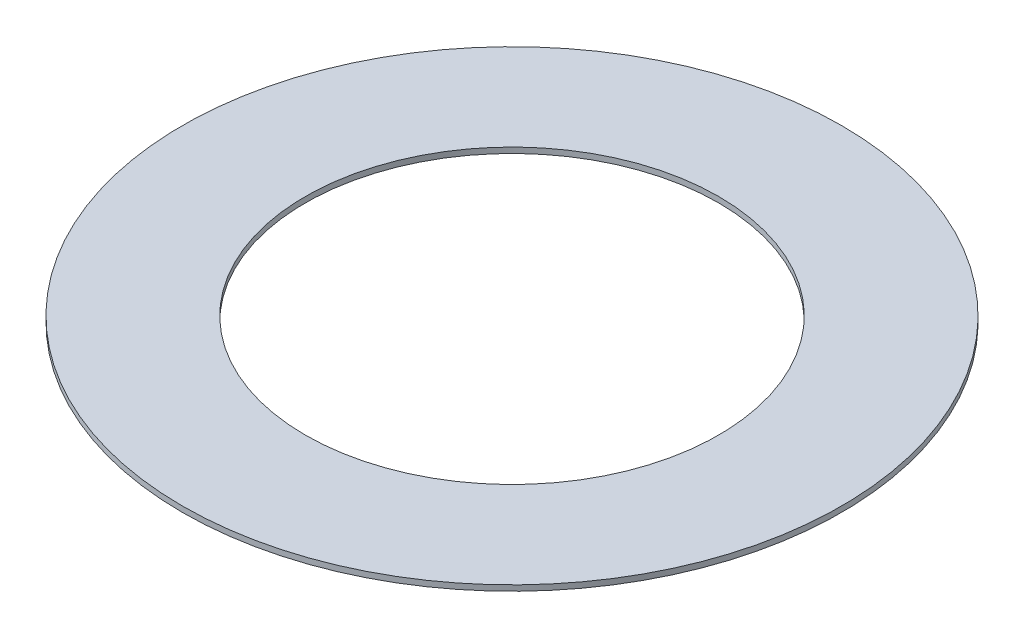
from build123d import *

# Parameters (mm, degrees)
SKETCH1_R           = 29.5
BOSS_EXTRUDE1_DEPTH = 0.5
SKETCH2_R           = 18.5
CUT_EXTRUDE1_DEPTH  = 42.722296198


with BuildPart() as part:
    # Sketch1 → Boss-Extrude1 (new body)
    with BuildSketch(Plane(origin=(0, 0, 0), x_dir=(1, 0, 0), z_dir=(0, 1, 0))):
        with Locations(Location((0, 0, 0), (0, 0, 270))):
            Circle(SKETCH1_R)
    extrude(amount=BOSS_EXTRUDE1_DEPTH)

    # Sketch2 → Cut-Extrude1 (cut, through all)
    with BuildSketch(Plane.XZ):
        with Locations(Location((0, 0, 0), (0, 0, 270))):
            Circle(SKETCH2_R)
    extrude(amount=-CUT_EXTRUDE1_DEPTH, mode=Mode.SUBTRACT)


solid = part.part
